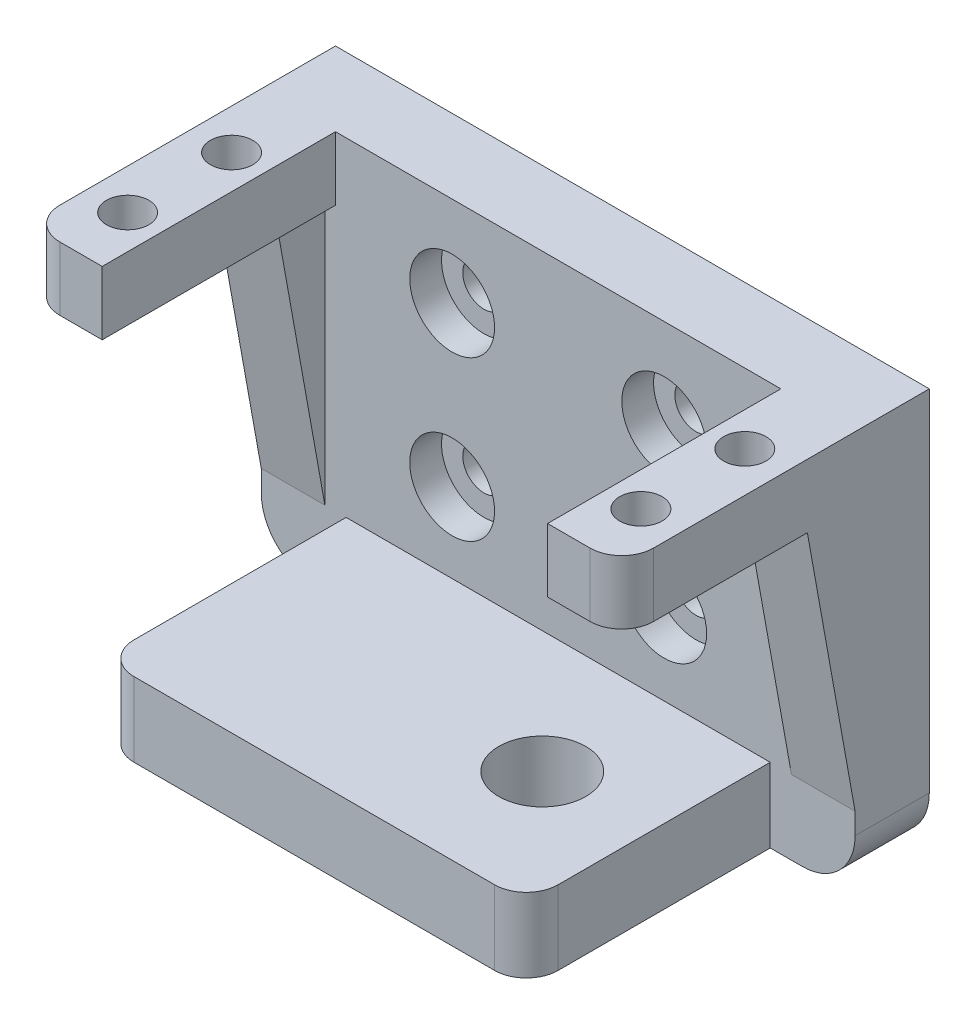
from build123d import *

# Parameters (mm, degrees)
EXTRUDE_START       = 74.5
SKETCH_4_R          = 2
EXTRUDE_1_DEPTH     = 6
SKETCH_5_W          = 40
SKETCH_5_H          = 32
SKETCH_5_R          = 2
EXTRUDE_2_DEPTH     = 7
CUT_EXTRUDE_START   = -21.5
SKETCH_6_R          = 4
CUT_EXTRUDE_1_DEPTH = 3
EXTRUDE_START_2     = 42.5
SKETCH_7_R          = 4.1
EXTRUDE_3_DEPTH     = 7
SKETCH_8_R          = 4.9
CUT_EXTRUDE_2_DEPTH = 0.9
EXTRUDE_START_3     = 2
EXTRUDE_4_DEPTH     = 6
EXTRUDE_5_DEPTH     = 6
SKETCH_13_W         = 30
SKETCH_13_H         = 25
EXTRUDE_6_DEPTH     = 7


with BuildPart() as part:
    # 草图4 → 凸台-拉伸1 (new body)
    with BuildSketch(Plane(origin=(0, 0, 0), x_dir=(1, 0, 0), z_dir=(0, 1, 0)).offset(EXTRUDE_START)):
        with BuildLine():
            Line((-28, 28.5), (28, 28.5))
            Line((28, 28.5), (28, 2.5))
            ThreePointArc((28, 2.5), (27.121320344, 0.378679656), (25, -0.5))
            Line((25, -0.5), (21, -0.5))
            Line((21, -0.5), (21, 21.5))
            Line((21, 21.5), (-21, 21.5))
            Line((-21, 21.5), (-21, -0.5))
            Line((-21, -0.5), (-25, -0.5))
            ThreePointArc((-25, -0.5), (-27.121320344, 0.378679656), (-28, 2.5))
            Line((-28, 2.5), (-28, 28.5))
        make_face()
        with Locations(Location((-24.2, 14.9, 0), (0, 0, 90))):
            Circle(SKETCH_4_R, mode=Mode.SUBTRACT)
        with Locations(Location((-24.2, 5.1, 0), (0, 0, 90))):
            Circle(SKETCH_4_R, mode=Mode.SUBTRACT)
        with Locations(Location((24.2, 14.9, 0), (0, 0, 90))):
            Circle(SKETCH_4_R, mode=Mode.SUBTRACT)
        with Locations(Location((24.2, 5.1, 0), (0, 0, 90))):
            Circle(SKETCH_4_R, mode=Mode.SUBTRACT)
    extrude(amount=EXTRUDE_1_DEPTH)

    # 草图5 → 凸台-拉伸2 (add)
    with BuildSketch(Plane(origin=(0, 0, -28.5), x_dir=(-1, 0, 0), z_dir=(0, 0, -1))):
        with Locations((0, 58.5)):
            Rectangle(SKETCH_5_W, SKETCH_5_H)
        with Locations((-10, 72)):
            Circle(SKETCH_5_R, mode=Mode.SUBTRACT)
        with Locations(Location((10, 72, 0), (0, 0, 180))):
            Circle(SKETCH_5_R, mode=Mode.SUBTRACT)
        with Locations((10, 57)):
            Circle(SKETCH_5_R, mode=Mode.SUBTRACT)
        with Locations(Location((-10, 57, 0), (0, 0, 180))):
            Circle(SKETCH_5_R, mode=Mode.SUBTRACT)
    extrude(amount=-EXTRUDE_2_DEPTH)

    # 草图6 → 切除-拉伸1 (cut)
    with BuildSketch(Plane.XY.offset(CUT_EXTRUDE_START)):
        with Locations((-10, 72)):
            Circle(SKETCH_6_R)
        with Locations((10, 72)):
            Circle(SKETCH_6_R)
        with Locations((-10, 57)):
            Circle(SKETCH_6_R)
        with Locations((10, 57)):
            Circle(SKETCH_6_R)
    extrude(amount=-CUT_EXTRUDE_1_DEPTH, mode=Mode.SUBTRACT)

    # 草图7 → 凸台-拉伸3 (add)
    with BuildSketch(Plane(origin=(0, 0, 0), x_dir=(1, 0, 0), z_dir=(0, 1, 0)).offset(EXTRUDE_START_2)):
        with BuildLine():
            Line((20, 21.5), (-20, 21.5))
            Line((-20, 21.5), (-20, 1.5))
            ThreePointArc((-20, 1.5), (-19.121320344, -0.621320344), (-17, -1.5))
            Line((-17, -1.5), (17, -1.5))
            ThreePointArc((17, -1.5), (19.121320344, -0.621320344), (20, 1.5))
            Line((20, 1.5), (20, 21.5))
        make_face()
        with Locations(Location((10, 10, 0), (0, 0, 90))):
            Circle(SKETCH_7_R, mode=Mode.SUBTRACT)
    extrude(amount=EXTRUDE_3_DEPTH)

    # 草图8 → 切除-拉伸2 (cut)
    with BuildSketch(Plane.XZ.offset(-42.5)):
        with Locations(Location((10, -10, 0), (0, 0, 270))):
            Circle(SKETCH_8_R)
    extrude(amount=-CUT_EXTRUDE_2_DEPTH, mode=Mode.SUBTRACT)

    # 草图10 → 凸台-拉伸4 (add)
    with BuildSketch(Plane(origin=(20, 0, 0), x_dir=(0, 0, -1), z_dir=(1, 0, 0)).offset(EXTRUDE_START_3)):
        Polygon((28.5, 49.5), (28.5, 74.5), (17, 74.5), (21.5, 49.5), align=None)
    extrude(amount=EXTRUDE_4_DEPTH)

    # 草图12 → 凸台-拉伸5 (add)
    with BuildSketch(Plane.ZY.offset(20).offset(EXTRUDE_START_3)):
        Polygon((-21.5, 49.5), (-28.5, 49.5), (-28.5, 74.5), (-17, 74.5), align=None)
    extrude(amount=EXTRUDE_5_DEPTH)

    # 草图13 → 凸台-拉伸6 (add)
    with BuildSketch(Plane(origin=(0, 0, -28.5), x_dir=(-1, 0, 0), z_dir=(0, 0, -1))):
        with BuildLine():
            Line((28, 80.5), (-28, 80.5))
            Line((-28, 80.5), (-28, 47.5))
            ThreePointArc((-28, 47.5), (-26.535533906, 43.964466094), (-23, 42.5))
            Line((-23, 42.5), (23, 42.5))
            ThreePointArc((23, 42.5), (26.535533906, 43.964466094), (28, 47.5))
            Line((28, 47.5), (28, 80.5))
        make_face()
        with Locations((0, 65)):
            Rectangle(SKETCH_13_W, SKETCH_13_H, mode=Mode.SUBTRACT)
    extrude(amount=-EXTRUDE_6_DEPTH)


solid = part.part
